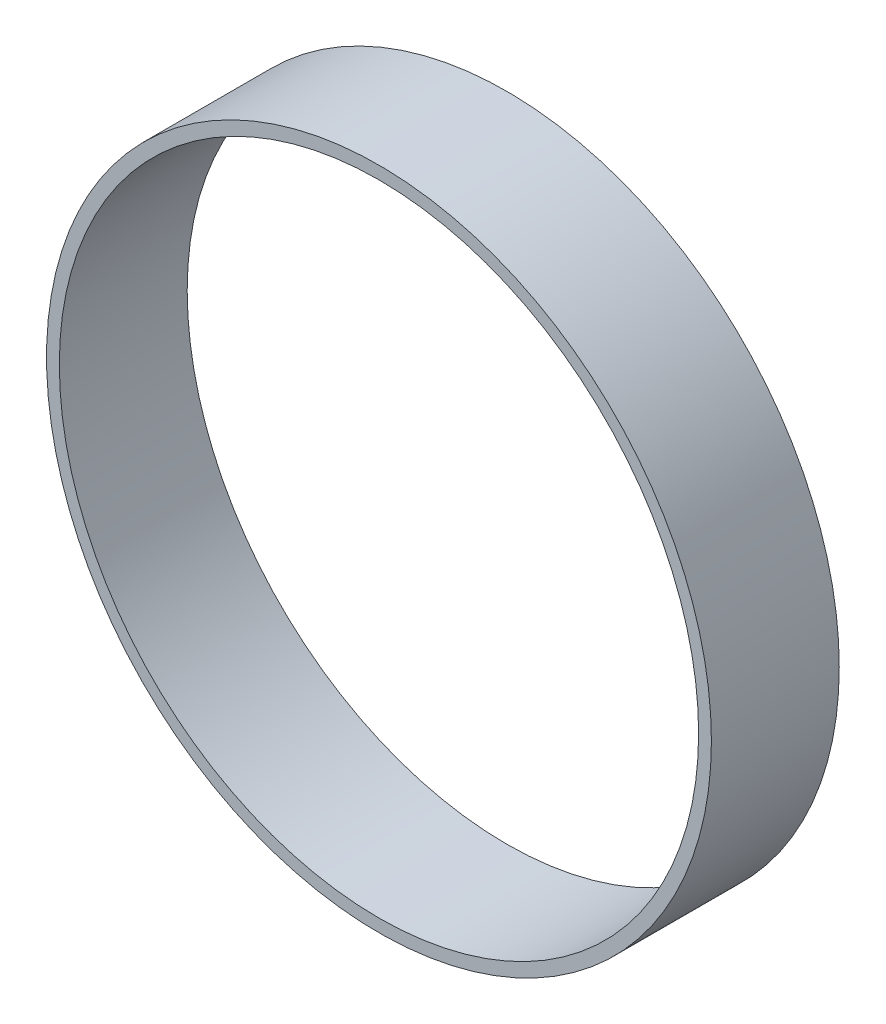
from build123d import *

# Parameters (mm, degrees)
SKETCH2_R           = 26
SKETCH2_R_2         = 25
BOSS_EXTRUDE1_DEPTH = 10


with BuildPart() as part:
    # Sketch2 → Boss-Extrude1 (new body)
    with BuildSketch(Plane.XY):
        Circle(SKETCH2_R)
        Circle(SKETCH2_R_2, mode=Mode.SUBTRACT)
    extrude(amount=BOSS_EXTRUDE1_DEPTH)


solid = part.part
